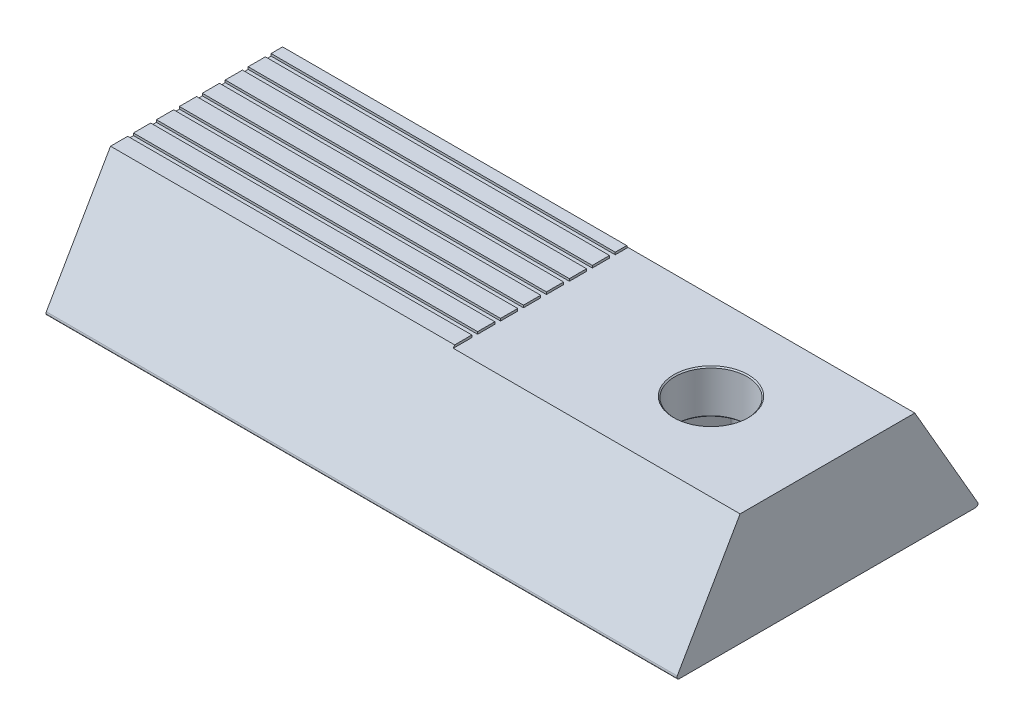
from build123d import *

# Parameters (mm, degrees)
SKETCH1_R                       = 3.15
BOSS_EXTRUDE1_DEPTH             = 10
CUT_EXTRUDE2_DEPTH              = 42.907636536
CUT_EXTRUDE2_DEPTH_BACK         = 42.907636536
SKETCH2_W                       = 0.5
SKETCH2_H                       = 0.2
BOSS_EXTRUDE2_REACH             = 43.908
BOSS_EXTRUDE2_DIRECTION_2_REACH = 43.908
SKETCH10_W                      = 15.230940108
SKETCH10_H                      = 0.2
CUT_EXTRUDE6_DEPTH              = 25
CUT_EXTRUDE5_DEPTH              = 6
FILLET3_R                       = 0.5
CHAMFER1_SIZE                   = 0.1


with BuildPart() as part:
    # Sketch1 → Boss-Extrude1 (new body)
    with BuildSketch(Plane(origin=(0, 0, 0), x_dir=(1, 0, 0), z_dir=(0, 1, 0))):
        Polygon((-15, -7.5), (15, -7.5), (40, -7.5), (40, 7.5), (15, 7.5), (-15, 7.5), align=None)
        with Locations(Location((29.85, 0, 0), (0, 0, 270))):
            Circle(SKETCH1_R, mode=Mode.SUBTRACT)
    extrude(amount=BOSS_EXTRUDE1_DEPTH)

    # Sketch2 → Cut-Extrude2 (cut, two sides: drawn at the far end of the back side and taken through both)
    with BuildSketch(Plane(origin=(0, 0, 0), x_dir=(0, 0, -1), z_dir=(1, 0, 0)).offset(-CUT_EXTRUDE2_DEPTH_BACK)):
        with Locations((-5.75, 9.9)):
            Rectangle(SKETCH2_W, SKETCH2_H)
        with Locations((-3.75, 9.9)):
            Rectangle(SKETCH2_W, SKETCH2_H)
        with Locations((-1.75, 9.9)):
            Rectangle(SKETCH2_W, SKETCH2_H)
        with Locations((0.25, 9.9)):
            Rectangle(SKETCH2_W, SKETCH2_H)
        with Locations((2.25, 9.9)):
            Rectangle(SKETCH2_W, SKETCH2_H)
        with Locations((4.25, 9.9)):
            Rectangle(SKETCH2_W, SKETCH2_H)
        with Locations((6.25, 9.9)):
            Rectangle(SKETCH2_W, SKETCH2_H)
    extrude(amount=CUT_EXTRUDE2_DEPTH + CUT_EXTRUDE2_DEPTH_BACK, mode=Mode.SUBTRACT)

    # Boss-Extrude2: up to this face of the body (flat: up to its plane)
    boss_extrude2_end = Plane(part.part.faces().sort_by_distance((40, 4.977026122, 0.001172137))[0])
    # Sketch3 → Boss-Extrude2 (add, up to the picked face)
    with BuildSketch(Plane(origin=(0, 0, 0), x_dir=(0, 0, -1), z_dir=(1, 0, 0)), mode=Mode.PRIVATE) as boss_extrude2_sk1:
        with BuildLine():
            Line((7.5, 10), (13.097822121, 0.304287674))
            ThreePointArc((13.097822121, 0.304287674), (13.097822121, 0.101429225), (12.92214155, 0))
            Line((12.92214155, 0), (7.5, 0))
            Line((7.5, 0), (7.5, 10))
        make_face()
    boss_extrude2_tool1 = split(extrude(boss_extrude2_sk1.sketch, amount=BOSS_EXTRUDE2_REACH, mode=Mode.PRIVATE), bisect_by=boss_extrude2_end, keep=Keep.BOTH, mode=Mode.PRIVATE)
    # Sketch3 → Boss-Extrude2 (add, up to the picked face)
    with BuildSketch(Plane(origin=(0, 0, 0), x_dir=(0, 0, -1), z_dir=(1, 0, 0)), mode=Mode.PRIVATE) as boss_extrude2_sk2:
        with BuildLine():
            Line((-7.5, 0), (-7.5, 10))
            Line((-7.5, 10), (-13.097822121, 0.304287674))
            ThreePointArc((-13.097822121, 0.304287674), (-13.097822121, 0.101429225), (-12.92214155, 0))
            Line((-12.92214155, 0), (-7.5, 0))
        make_face()
    boss_extrude2_tool2 = split(extrude(boss_extrude2_sk2.sketch, amount=BOSS_EXTRUDE2_REACH, mode=Mode.PRIVATE), bisect_by=boss_extrude2_end, keep=Keep.BOTH, mode=Mode.PRIVATE)
    add(boss_extrude2_tool1.solids().sort_by(Axis((0, 3.336518, -9.420866), (1, 0, 0)))[0])
    add(boss_extrude2_tool2.solids().sort_by(Axis((0, 3.336518, 9.420866), (1, 0, 0)))[0])

    # Boss-Extrude2 direction 2: up to this face of the body (flat: up to its plane)
    boss_extrude2_direction_2_end = Plane(part.part.faces().sort_by_distance((-15, 4.977026122, 0.001172137))[0])
    # Sketch3 → Boss-Extrude2 direction 2 (add, up to the picked face)
    with BuildSketch(Plane(origin=(0, 0, 0), x_dir=(0, 0, -1), z_dir=(1, 0, 0)), mode=Mode.PRIVATE) as boss_extrude2_direction_2_sk1:
        with BuildLine():
            Line((7.5, 10), (13.097822121, 0.304287674))
            ThreePointArc((13.097822121, 0.304287674), (13.097822121, 0.101429225), (12.92214155, 0))
            Line((12.92214155, 0), (7.5, 0))
            Line((7.5, 0), (7.5, 10))
        make_face()
    boss_extrude2_direction_2_tool1 = split(extrude(boss_extrude2_direction_2_sk1.sketch, amount=-BOSS_EXTRUDE2_DIRECTION_2_REACH, mode=Mode.PRIVATE), bisect_by=boss_extrude2_direction_2_end, keep=Keep.BOTH, mode=Mode.PRIVATE)
    # Sketch3 → Boss-Extrude2 direction 2 (add, up to the picked face)
    with BuildSketch(Plane(origin=(0, 0, 0), x_dir=(0, 0, -1), z_dir=(1, 0, 0)), mode=Mode.PRIVATE) as boss_extrude2_direction_2_sk2:
        with BuildLine():
            Line((-7.5, 0), (-7.5, 10))
            Line((-7.5, 10), (-13.097822121, 0.304287674))
            ThreePointArc((-13.097822121, 0.304287674), (-13.097822121, 0.101429225), (-12.92214155, 0))
            Line((-12.92214155, 0), (-7.5, 0))
        make_face()
    boss_extrude2_direction_2_tool2 = split(extrude(boss_extrude2_direction_2_sk2.sketch, amount=-BOSS_EXTRUDE2_DIRECTION_2_REACH, mode=Mode.PRIVATE), bisect_by=boss_extrude2_direction_2_end, keep=Keep.BOTH, mode=Mode.PRIVATE)
    add(boss_extrude2_direction_2_tool1.solids().sort_by(Axis((0, 3.336518, -9.420866), (-1, 0, 0)))[0])
    add(boss_extrude2_direction_2_tool2.solids().sort_by(Axis((0, 3.336518, 9.420866), (-1, 0, 0)))[0])

    # Sketch10 → Cut-Extrude6 (cut)
    with BuildSketch(Plane(origin=(40, 0, 0), x_dir=(0, 0, -1), z_dir=(1, 0, 0))):
        with Locations((0, 9.9)):
            Rectangle(SKETCH10_W, SKETCH10_H)
    extrude(amount=-CUT_EXTRUDE6_DEPTH, mode=Mode.SUBTRACT)

    # Sketch8 → Cut-Extrude5 (cut)
    with BuildSketch(Plane.XZ):
        Polygon((26.905513627, -5.1), (32.794486373, -5.1), (35.738972746, 0), (32.794486373, 5.1), (26.905513627, 5.1), (23.961027254, 0), align=None)
    extrude(amount=-CUT_EXTRUDE5_DEPTH, mode=Mode.SUBTRACT)

    # Fillet3
    fillet3_edges = [part.edges().sort_by_distance(p)[0] for p in [
        (26.905513627, 3, -5.1),
        (23.961027254, 3, 0),
        (26.905513627, 3, 5.1),
        (32.794486373, 3, 5.1),
        (35.738972746, 3, 0),
        (32.794486373, 3, -5.1),
    ]]
    fillet(fillet3_edges, radius=FILLET3_R)

    # Chamfer1
    chamfer1_edges = [part.edges().sort_by_distance(p)[0] for p in [
        (29.85, 9.8, -3.15),
        (29.85, 6, -3.15),
    ]]
    chamfer(chamfer1_edges, length=CHAMFER1_SIZE)


solid = part.part
